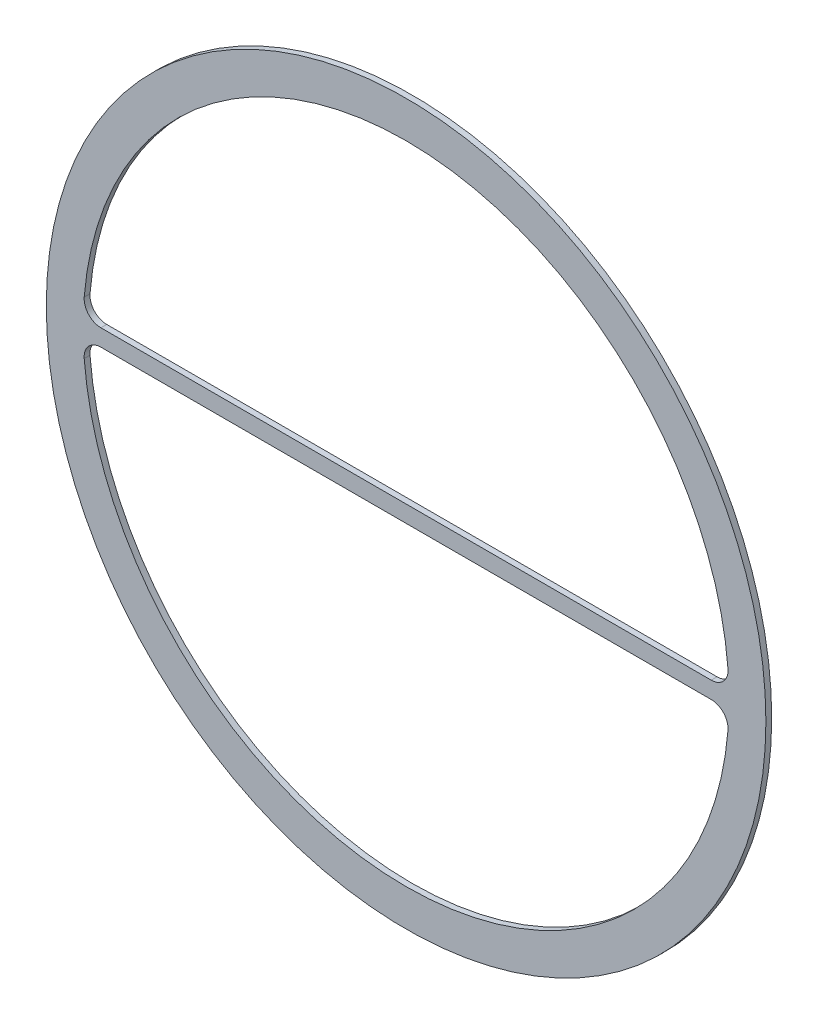
from build123d import *

# Parameters (mm, degrees)
SKETCH1_R           = 278.5
BOSS_EXTRUDE2_DEPTH = 4.5
FILLET1_R           = 13


with BuildPart() as part:
    # Sketch1 → Boss-Extrude2 (new body)
    with BuildSketch(Plane.XY):
        Circle(SKETCH1_R)
        with BuildLine():
            ThreePointArc((249.915485715, -6.5), (0, -250), (-249.915485715, -6.5))
            Line((-249.915485715, -6.5), (249.915485715, -6.5))
        make_face(mode=Mode.SUBTRACT)
        with BuildLine():
            Line((249.915485715, 6.5), (-249.915485715, 6.5))
            ThreePointArc((-249.915485715, 6.5), (0, 250), (249.915485715, 6.5))
        make_face(mode=Mode.SUBTRACT)
    extrude(amount=BOSS_EXTRUDE2_DEPTH)

    # Fillet1
    fillet1_edges = [part.edges().sort_by_distance(p)[0] for p in [
        (249.915485715, -6.5, 2.25),
        (-249.915485715, -6.5, 2.25),
        (-249.915485715, 6.5, 2.25),
        (249.915485715, 6.5, 2.25),
    ]]
    fillet(fillet1_edges, radius=FILLET1_R)


solid = part.part
